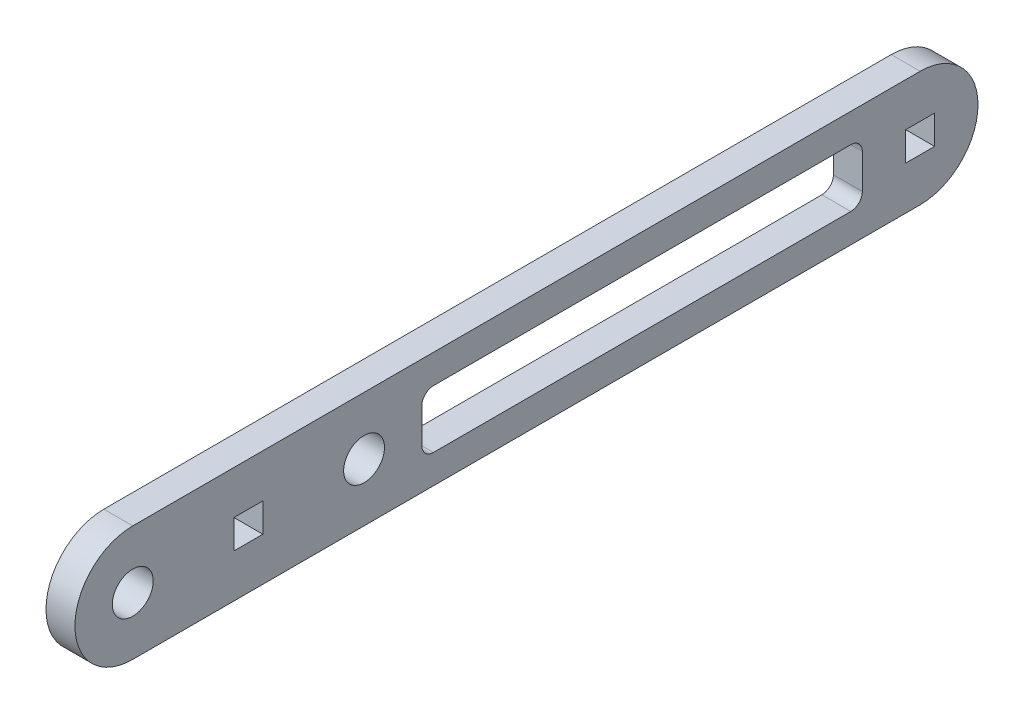
from build123d import *

# Parameters (mm, degrees)
SKETCH1_R           = 2.24506403
SKETCH1_W           = 3.175
SKETCH1_H           = 3.175
BOSS_EXTRUDE1_DEPTH = 3.175


with BuildPart() as part:
    # Sketch1 → Boss-Extrude1 (new body)
    with BuildSketch(Plane(origin=(0, 0, 0), x_dir=(0, 0, -1), z_dir=(1, 0, 0))):
        with BuildLine():
            Line((-86.4616, 6.35), (0, 6.35))
            ThreePointArc((0, 6.35), (6.35, 0), (0, -6.35))
            Line((0, -6.35), (-86.4616, -6.35))
            ThreePointArc((-86.4616, -6.35), (-92.8116, 0), (-86.4616, 6.35))
        make_face()
        with Locations((-61.0616, 0)):
            Circle(SKETCH1_R, mode=Mode.SUBTRACT)
        with Locations((-86.4616, 0)):
            Circle(SKETCH1_R, mode=Mode.SUBTRACT)
        with Locations((-73.7616, 0)):
            Rectangle(SKETCH1_W, SKETCH1_H, mode=Mode.SUBTRACT)
        with BuildLine():
            Line((-54.7116, 0), (-54.7116, 1.905))
            ThreePointArc((-54.7116, 1.905), (-54.339625612, 2.803025612), (-53.4416, 3.175))
            Line((-53.4416, 3.175), (-7.62, 3.175))
            ThreePointArc((-7.62, 3.175), (-6.721974388, 2.803025612), (-6.35, 1.905))
            Line((-6.35, 1.905), (-6.35, -1.905))
            ThreePointArc((-6.35, -1.905), (-6.721974388, -2.803025612), (-7.62, -3.175))
            Line((-7.62, -3.175), (-53.4416, -3.175))
            ThreePointArc((-53.4416, -3.175), (-54.339625612, -2.803025612), (-54.7116, -1.905))
            Line((-54.7116, -1.905), (-54.7116, 0))
        make_face(mode=Mode.SUBTRACT)
        Rectangle(SKETCH1_W, SKETCH1_H, mode=Mode.SUBTRACT)
    extrude(amount=BOSS_EXTRUDE1_DEPTH)


solid = part.part
